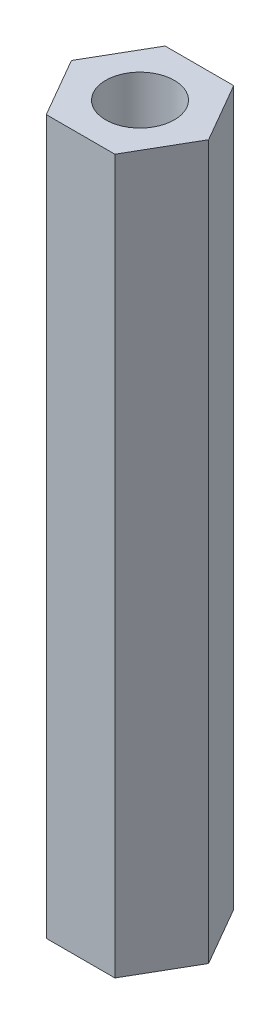
from build123d import *

# Parameters (mm, degrees)
SKETCH1_R           = 1.25
BOSS_EXTRUDE1_DEPTH = 13


with BuildPart() as part:
    # Sketch1 → Boss-Extrude1 (new, symmetric)
    with BuildSketch(Plane(origin=(0, 0, 0), x_dir=(1, 0, 0), z_dir=(0, 1, 0))):
        Polygon((1.25, -2.165063509), (2.5, 0), (1.25, 2.165063509), (-1.25, 2.165063509), (-2.5, 0), (-1.25, -2.165063509), align=None)
        with Locations(Location((0, 0, 0), (0, 0, 90))):
            Circle(SKETCH1_R, mode=Mode.SUBTRACT)
    extrude(amount=BOSS_EXTRUDE1_DEPTH, both=True)


solid = part.part
